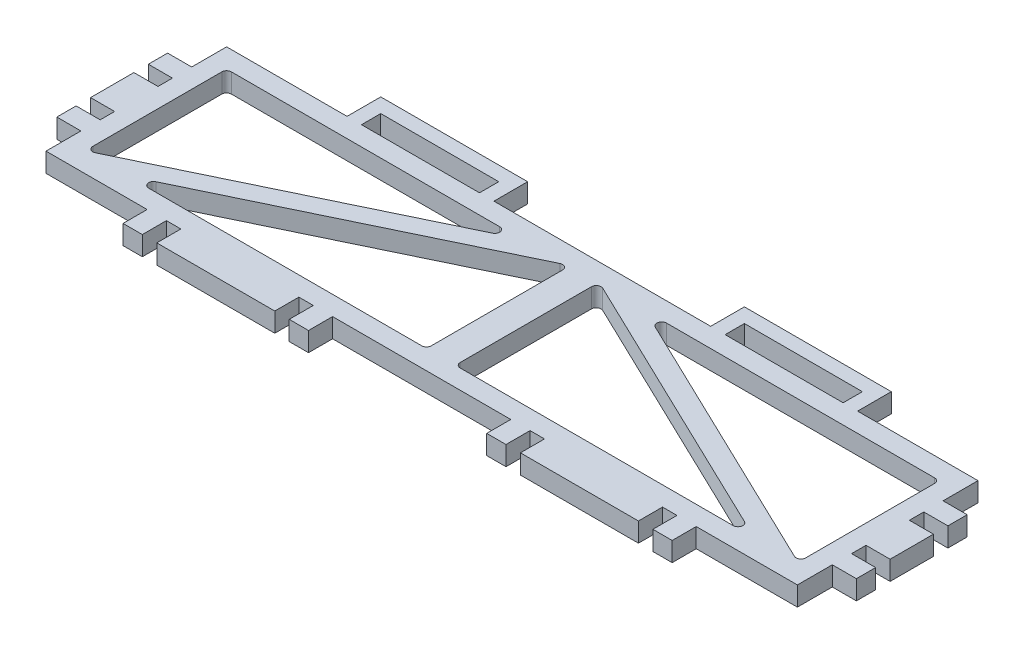
from build123d import *

# Parameters (mm, degrees)
SKETCH1_W           = 24.5
SKETCH1_H           = 4
BOSS_EXTRUDE1_DEPTH = 4
FILLET1_R           = 1


with BuildPart() as part:
    # Sketch1 → Boss-Extrude1 (new body)
    with BuildSketch(Plane(origin=(0, 0, 0), x_dir=(1, 0, 0), z_dir=(0, 1, 0))):
        Polygon((-53, 18.75), (-78, 18.75), (-78, 11.5), (-83, 11.5), (-83, 7.5), (-78, 7.5), (-78, 4.5), (-83, 4.5), (-83, -4.5), (-78, -4.5), (-78, -7.5), (-83, -7.5), (-83, -11.5), (-78, -11.5), (-78, -18.75), (-57, -18.75), (-57, -23.75), (-53, -23.75), (-53, -18.75), (-50, -18.75), (-50, -23.75), (-25.5, -23.75), (-25.5, -18.75), (-22.5, -18.75), (-22.5, -23.75), (-18.5, -23.75), (-18.5, -18.75), (18.5, -18.75), (18.5, -23.75), (22.5, -23.75), (22.5, -18.75), (25.5, -18.75), (25.5, -23.75), (50, -23.75), (50, -18.75), (53, -18.75), (53, -23.75), (57, -23.75), (57, -18.75), (78, -18.75), (78, -11.5), (83, -11.5), (83, -7.5), (78, -7.5), (78, -4.5), (83, -4.5), (83, 4.5), (78, 4.5), (78, 7.5), (83, 7.5), (83, 11.5), (78, 11.5), (78, 18.75), (53, 18.75), (53, 25.75), (22.5, 25.75), (22.5, 18.75), (-22.5, 18.75), (-22.5, 25.75), (-53, 25.75), align=None)
        with Locations((37.75, 20.75)):
            Rectangle(SKETCH1_W, SKETCH1_H, mode=Mode.SUBTRACT)
        with Locations((-37.75, 20.75)):
            Rectangle(SKETCH1_W, SKETCH1_H, mode=Mode.SUBTRACT)
        Polygon((-12.935798956, 14.75), (-74, -14.607788964), (-74, 14.75), align=None, mode=Mode.SUBTRACT)
        Polygon((-3, 15.088558194), (-3, -14.75), (-65.064201044, -14.75), align=None, mode=Mode.SUBTRACT)
        Polygon((3, -14.75), (3, 15.088558194), (65.064201044, -14.75), align=None, mode=Mode.SUBTRACT)
        Polygon((74, -14.607788964), (12.935798956, 14.75), (74, 14.75), align=None, mode=Mode.SUBTRACT)
    extrude(amount=BOSS_EXTRUDE1_DEPTH)

    # Fillet1
    fillet1_edges = [part.edges().sort_by_distance(p)[0] for p in [
        (-74, 2, 14.607788964),
        (-12.935798956, 2, -14.75),
        (-74, 2, -14.75),
        (65.064201044, 2, 14.75),
        (3, 2, -15.088558194),
        (3, 2, 14.75),
        (12.935798956, 2, -14.75),
        (74, 2, 14.607788964),
        (74, 2, -14.75),
        (-65.064201044, 2, 14.75),
        (-3, 2, 14.75),
        (-3, 2, -15.088558194),
    ]]
    fillet(fillet1_edges, radius=FILLET1_R)


solid = part.part
